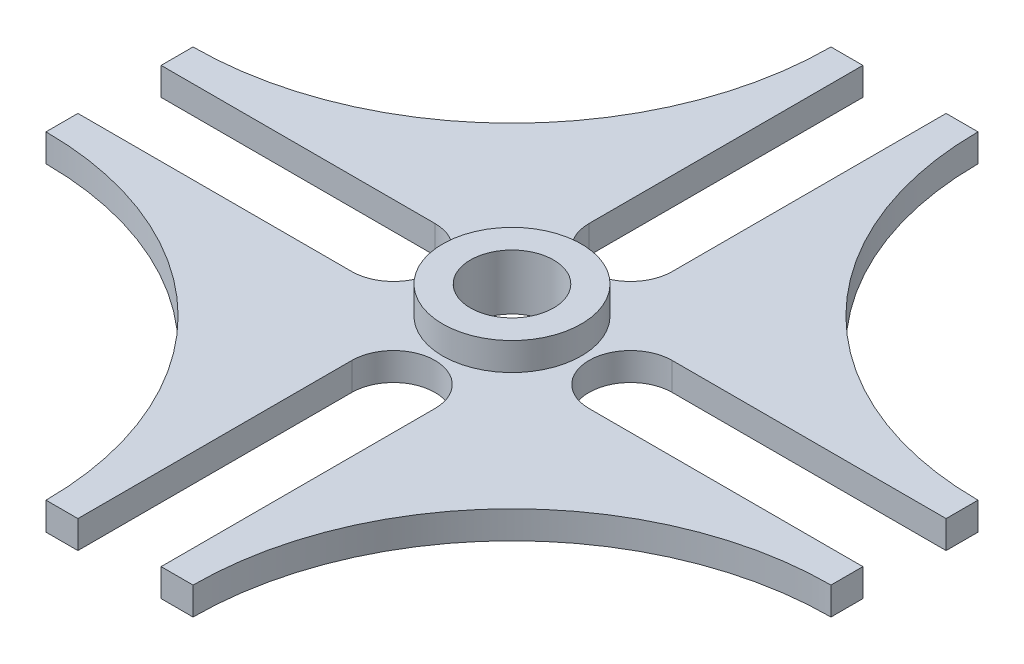
from build123d import *

# Parameters (mm, degrees)
BOSS_EXTRUDE1_DEPTH = 4
SKETCH2_R           = 10
BOSS_EXTRUDE2_DEPTH = 4
SKETCH3_R           = 6
CUT_EXTRUDE1_DEPTH  = 81.443271937


with BuildPart() as part:
    # Sketch1 → Boss-Extrude1 (new body)
    with BuildSketch(Plane(origin=(0, 0, 0), x_dir=(1, 0, 0), z_dir=(0, 1, 0))):
        with BuildLine():
            Line((6, 56.6), (6, 17.1))
            ThreePointArc((6, 17.1), (0, 11.1), (-6, 17.1))
            Line((-6, 17.1), (-6, 56.6))
            Line((-6, 56.6), (-10.6, 56.6))
            ThreePointArc((-10.6, 56.6), (-24.073088065, 24.073088065), (-56.6, 10.6))
            Line((-56.6, 10.6), (-56.6, 6))
            Line((-56.6, 6), (-17.1, 6))
            ThreePointArc((-17.1, 6), (-11.1, 0), (-17.1, -6))
            Line((-17.1, -6), (-56.6, -6))
            Line((-56.6, -6), (-56.6, -10.6))
            ThreePointArc((-56.6, -10.6), (-24.073088065, -24.073088065), (-10.6, -56.6))
            Line((-10.6, -56.6), (-6, -56.6))
            Line((-6, -56.6), (-6, -17.1))
            ThreePointArc((-6, -17.1), (0, -11.1), (6, -17.1))
            Line((6, -17.1), (6, -56.6))
            Line((6, -56.6), (10.6, -56.6))
            ThreePointArc((10.6, -56.6), (24.073088065, -24.073088065), (56.6, -10.6))
            Line((56.6, -10.6), (56.6, -6))
            Line((56.6, -6), (17.1, -6))
            ThreePointArc((17.1, -6), (11.1, 0), (17.1, 6))
            Line((17.1, 6), (56.6, 6))
            Line((56.6, 6), (56.6, 10.6))
            ThreePointArc((56.6, 10.6), (24.073088065, 24.073088065), (10.6, 56.6))
            Line((10.6, 56.6), (6, 56.6))
        make_face()
    extrude(amount=BOSS_EXTRUDE1_DEPTH)

    # Sketch2 → Boss-Extrude2 (add)
    with BuildSketch(Plane(origin=(0, 4, 0), x_dir=(1, 0, 0), z_dir=(0, 1, 0))):
        with Locations(Location((0, 0, 0), (0, 0, 270))):
            Circle(SKETCH2_R)
    extrude(amount=BOSS_EXTRUDE2_DEPTH)

    # Sketch3 → Cut-Extrude1 (cut, through all)
    with BuildSketch(Plane(origin=(0, 8, 0), x_dir=(1, 0, 0), z_dir=(0, 1, 0))):
        with Locations(Location((0, 0, 0), (0, 0, 270))):
            Circle(SKETCH3_R)
    extrude(amount=-CUT_EXTRUDE1_DEPTH, mode=Mode.SUBTRACT)


solid = part.part
